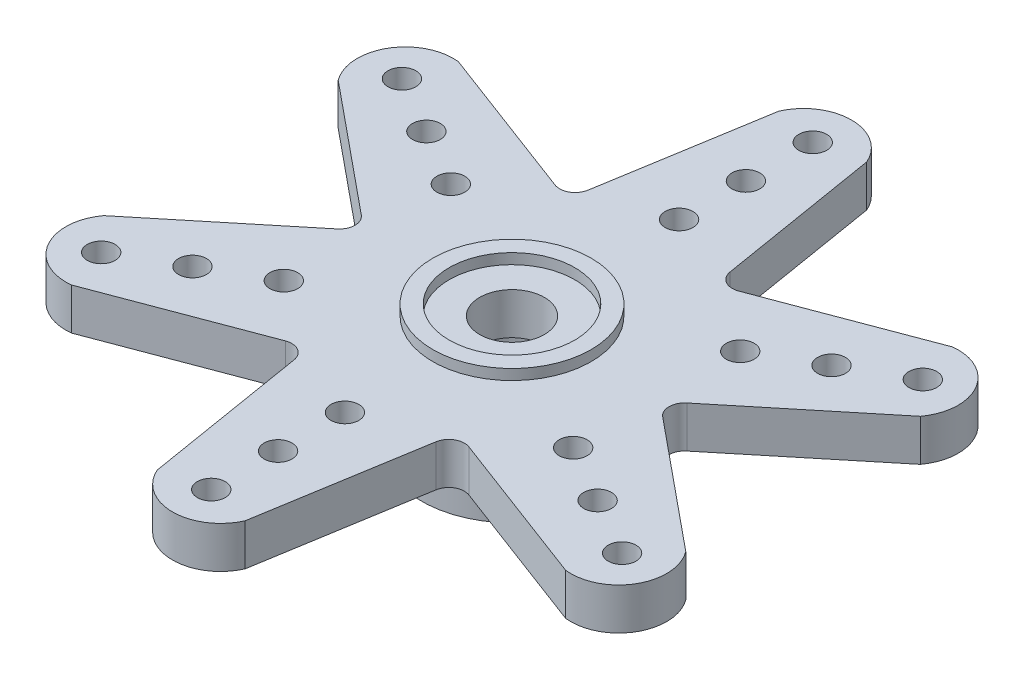
from build123d import *

# Parameters (mm, degrees)
SKETCH1_R           = 4.064
SKETCH1_R_2         = 2.794
BOSS_EXTRUDE1_DEPTH = 3.302
SKETCH2_R           = 0.62500002
BOSS_EXTRUDE2_DEPTH = 1.87000007
SKETCH4_R           = 1.449999894
CUT_EXTRUDE1_DEPTH  = 21.9977138
SKETCH5_R           = 3.555000002
SKETCH5_R_2         = 2.819999948
BOSS_EXTRUDE3_DEPTH = 0.470000076


with BuildPart() as part:
    # Sketch1 → Boss-Extrude1 (new body)
    with BuildSketch(Plane(origin=(0, 0, 0), x_dir=(1, 0, 0), z_dir=(0, 1, 0))):
        with Locations(Location((0, 0, 0), (0, 0, 90))):
            Circle(SKETCH1_R)
        with Locations(Location((0, 0, 0), (0, 0, 90))):
            Circle(SKETCH1_R_2, mode=Mode.SUBTRACT)
    extrude(amount=BOSS_EXTRUDE1_DEPTH)

    # Sketch2 → Boss-Extrude2 (add)
    with BuildSketch(Plane(origin=(0, 3.302, 0), x_dir=(1, 0, 0), z_dir=(0, 1, 0))):
        with BuildLine():
            Line((3.184398134, 6.598095019), (1.973411671, 13.950499548))
            ThreePointArc((1.973411671, 13.950499548), (0, 15.24), (-1.973411671, 13.950499548))
            Line((-1.973411671, 13.950499548), (-3.184398134, 6.598095019))
            ThreePointArc((-3.184398134, 6.598095019), (-3.525092211, 6.105638812), (-4.121918835, 6.05681719))
            Line((-4.121918835, 6.05681719), (-11.094781168, 8.684274414))
            ThreePointArc((-11.094781168, 8.684274414), (-13.198227153, 7.620000001), (-13.068192838, 5.266225136))
            Line((-13.068192838, 5.266225136), (-7.306316969, 0.54127783))
            ThreePointArc((-7.306316969, 0.54127783), (-7.050184422, 1e-09), (-7.306316969, -0.541277828))
            Line((-7.306316969, -0.541277828), (-13.068192838, -5.266225133))
            ThreePointArc((-13.068192838, -5.266225133), (-13.198227153, -7.619999998), (-11.094781167, -8.684274411))
            Line((-11.094781167, -8.684274411), (-4.121918835, -6.056817187))
            ThreePointArc((-4.121918835, -6.056817187), (-3.525092211, -6.10563881), (-3.184398134, -6.598095016))
            Line((-3.184398134, -6.598095016), (-1.973411671, -13.950499545))
            ThreePointArc((-1.973411671, -13.950499545), (0, -15.239999997), (1.973411671, -13.950499545))
            Line((1.973411671, -13.950499545), (3.184398134, -6.598095017))
            ThreePointArc((3.184398134, -6.598095017), (3.525092211, -6.10563881), (4.121918835, -6.056817187))
            Line((4.121918835, -6.056817187), (11.094781168, -8.684274411))
            ThreePointArc((11.094781168, -8.684274411), (13.198227153, -7.619999998), (13.068192838, -5.266225133))
            Line((13.068192838, -5.266225133), (7.306316969, -0.541277828))
            ThreePointArc((7.306316969, -0.541277828), (7.050184422, 1e-09), (7.306316969, 0.54127783))
            Line((7.306316969, 0.54127783), (13.068192838, 5.266225136))
            ThreePointArc((13.068192838, 5.266225136), (13.198227153, 7.620000001), (11.094781167, 8.684274413))
            Line((11.094781167, 8.684274413), (4.121918835, 6.05681719))
            ThreePointArc((4.121918835, 6.05681719), (3.525092211, 6.105638812), (3.184398134, 6.598095019))
        make_face()
        with Locations(Location((0, -7.50046633, 0), (0, 0, 270))):
            Circle(SKETCH2_R, mode=Mode.SUBTRACT)
        with Locations(Location((0, -10.500466426, 0), (0, 0, 270))):
            Circle(SKETCH2_R, mode=Mode.SUBTRACT)
        with Locations(Location((0, -13.500466522, 0), (0, 0, 270))):
            Circle(SKETCH2_R, mode=Mode.SUBTRACT)
        with Locations(Location((-11.691746971, -6.750233261, 0), (0, 0, 270))):
            Circle(SKETCH2_R, mode=Mode.SUBTRACT)
        with Locations(Location((-9.093670677, -5.250233213, 0), (0, 0, 270))):
            Circle(SKETCH2_R, mode=Mode.SUBTRACT)
        with Locations(Location((-6.495594382, -3.750233165, 0), (0, 0, 270))):
            Circle(SKETCH2_R, mode=Mode.SUBTRACT)
        with Locations(Location((-11.691746971, 6.750233261, 0), (0, 0, 270))):
            Circle(SKETCH2_R, mode=Mode.SUBTRACT)
        with Locations(Location((-9.093670677, 5.250233213, 0), (0, 0, 270))):
            Circle(SKETCH2_R, mode=Mode.SUBTRACT)
        with Locations(Location((-6.495594382, 3.750233165, 0), (0, 0, 270))):
            Circle(SKETCH2_R, mode=Mode.SUBTRACT)
        with Locations(Location((0, 13.500466522, 0), (0, 0, 270))):
            Circle(SKETCH2_R, mode=Mode.SUBTRACT)
        with Locations(Location((0, 10.500466426, 0), (0, 0, 270))):
            Circle(SKETCH2_R, mode=Mode.SUBTRACT)
        with Locations(Location((0, 7.50046633, 0), (0, 0, 270))):
            Circle(SKETCH2_R, mode=Mode.SUBTRACT)
        with Locations(Location((11.691746971, 6.750233261, 0), (0, 0, 270))):
            Circle(SKETCH2_R, mode=Mode.SUBTRACT)
        with Locations(Location((9.093670677, 5.250233213, 0), (0, 0, 270))):
            Circle(SKETCH2_R, mode=Mode.SUBTRACT)
        with Locations(Location((6.495594382, 3.750233165, 0), (0, 0, 270))):
            Circle(SKETCH2_R, mode=Mode.SUBTRACT)
        with Locations(Location((11.691746971, -6.750233261, 0), (0, 0, 270))):
            Circle(SKETCH2_R, mode=Mode.SUBTRACT)
        with Locations(Location((9.093670677, -5.250233213, 0), (0, 0, 270))):
            Circle(SKETCH2_R, mode=Mode.SUBTRACT)
        with Locations(Location((6.495594382, -3.750233165, 0), (0, 0, 270))):
            Circle(SKETCH2_R, mode=Mode.SUBTRACT)
    extrude(amount=BOSS_EXTRUDE2_DEPTH)

    # Sketch4 → Cut-Extrude1 (cut, through all)
    with BuildSketch(Plane(origin=(0, 5.17200007, 0), x_dir=(1, 0, 0), z_dir=(0, 1, 0))):
        with Locations(Location((0, 0, 0), (0, 0, 270))):
            Circle(SKETCH4_R)
    extrude(amount=-CUT_EXTRUDE1_DEPTH, mode=Mode.SUBTRACT)

    # Sketch5 → Boss-Extrude3 (add)
    with BuildSketch(Plane(origin=(0, 5.17200007, 0), x_dir=(1, 0, 0), z_dir=(0, 1, 0))):
        with Locations(Location((0, 0, 0), (0, 0, 90))):
            Circle(SKETCH5_R)
        with Locations(Location((0, 0, 0), (0, 0, 270))):
            Circle(SKETCH5_R_2, mode=Mode.SUBTRACT)
    extrude(amount=BOSS_EXTRUDE3_DEPTH)


solid = part.part
